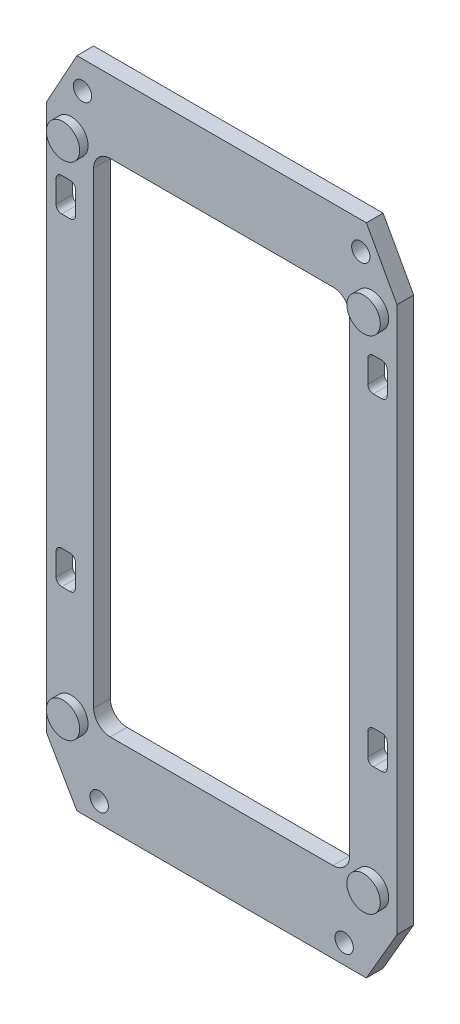
from build123d import *

# Parameters (mm, degrees)
SKETCH_4_R            = 1.65
EXTRUDE_258_DEPTH     = 3
CUT_EXTRUDE_383_DEPTH = 3
PCB_1P5MM_START       = 3
SKETCH_6_R            = 3
PCB_1P5MM_DEPTH       = 1.5


with BuildPart() as part:
    # 草图4 → Extrude 258 (new body)
    with BuildSketch(Plane.XY):
        Polygon((-26, -59.5), (26, -59.5), (31.5, -50), (31.5, 48), (26, 58), (-26, 58), (-31.5, 48), (-31.5, -50), align=None)
        with Locations((-22, -56)):
            Circle(SKETCH_4_R, mode=Mode.SUBTRACT)
        with Locations((-25, 53)):
            Circle(SKETCH_4_R, mode=Mode.SUBTRACT)
        with Locations((22, -56)):
            Circle(SKETCH_4_R, mode=Mode.SUBTRACT)
        with Locations((25, 53)):
            Circle(SKETCH_4_R, mode=Mode.SUBTRACT)
        with BuildLine():
            Line((-20, -45), (20, -45))
            ThreePointArc((20, -45), (22.121320344, -44.121320344), (23, -42))
            Line((23, -42), (23, 42))
            ThreePointArc((23, 42), (22.121320344, 44.121320344), (20, 45))
            Line((20, 45), (-20, 45))
            ThreePointArc((-20, 45), (-22.121320344, 44.121320344), (-23, 42))
            Line((-23, 42), (-23, -42))
            ThreePointArc((-23, -42), (-22.121320344, -44.121320344), (-20, -45))
        make_face(mode=Mode.SUBTRACT)
    extrude(amount=EXTRUDE_258_DEPTH)

    # 草图5 → Cut-Extrude 383 (cut)
    with BuildSketch(Plane.XY):
        with BuildLine():
            Line((-28.75, -26), (-27.25, -26))
            ThreePointArc((-27.25, -26), (-26.542893219, -25.707106781), (-26.25, -25))
            Line((-26.25, -25), (-26.25, -21))
            ThreePointArc((-26.25, -21), (-26.542893219, -20.292893219), (-27.25, -20))
            Line((-27.25, -20), (-28.75, -20))
            ThreePointArc((-28.75, -20), (-29.457106781, -20.292893219), (-29.75, -21))
            Line((-29.75, -21), (-29.75, -25))
            ThreePointArc((-29.75, -25), (-29.457106781, -25.707106781), (-28.75, -26))
        make_face()
        with BuildLine():
            Line((-28.75, 32), (-27.25, 32))
            ThreePointArc((-27.25, 32), (-26.542893219, 32.292893219), (-26.25, 33))
            Line((-26.25, 33), (-26.25, 37))
            ThreePointArc((-26.25, 37), (-26.542893219, 37.707106781), (-27.25, 38))
            Line((-27.25, 38), (-28.75, 38))
            ThreePointArc((-28.75, 38), (-29.457106781, 37.707106781), (-29.75, 37))
            Line((-29.75, 37), (-29.75, 33))
            ThreePointArc((-29.75, 33), (-29.457106781, 32.292893219), (-28.75, 32))
        make_face()
        with BuildLine():
            Line((27.25, -26), (28.75, -26))
            ThreePointArc((28.75, -26), (29.457106781, -25.707106781), (29.75, -25))
            Line((29.75, -25), (29.75, -21))
            ThreePointArc((29.75, -21), (29.457106781, -20.292893219), (28.75, -20))
            Line((28.75, -20), (27.25, -20))
            ThreePointArc((27.25, -20), (26.542893219, -20.292893219), (26.25, -21))
            Line((26.25, -21), (26.25, -25))
            ThreePointArc((26.25, -25), (26.542893219, -25.707106781), (27.25, -26))
        make_face()
        with BuildLine():
            Line((27.25, 32), (28.75, 32))
            ThreePointArc((28.75, 32), (29.457106781, 32.292893219), (29.75, 33))
            Line((29.75, 33), (29.75, 37))
            ThreePointArc((29.75, 37), (29.457106781, 37.707106781), (28.75, 38))
            Line((28.75, 38), (27.25, 38))
            ThreePointArc((27.25, 38), (26.542893219, 37.707106781), (26.25, 37))
            Line((26.25, 37), (26.25, 33))
            ThreePointArc((26.25, 33), (26.542893219, 32.292893219), (27.25, 32))
        make_face()
    extrude(amount=CUT_EXTRUDE_383_DEPTH, mode=Mode.SUBTRACT)

    # 草图6 → PCB下1p5mm绝缘支垫 (add)
    with BuildSketch(Plane.XY.offset(PCB_1P5MM_START)):
        with Locations((-27, -45)):
            Circle(SKETCH_6_R)
        with Locations((-27, 45)):
            Circle(SKETCH_6_R)
        with Locations((27, -45)):
            Circle(SKETCH_6_R)
        with Locations((27, 45)):
            Circle(SKETCH_6_R)
    extrude(amount=PCB_1P5MM_DEPTH)


solid = part.part
